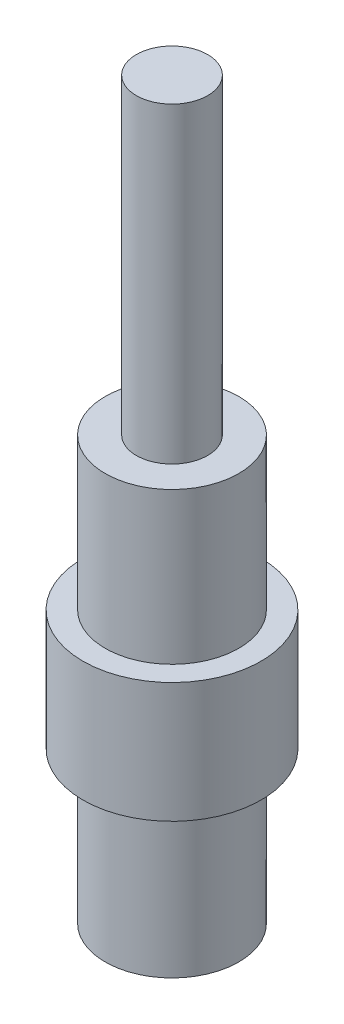
from build123d import *


with BuildPart() as part:
    # Szkic1 → Obrót1 (revolve)
    with BuildSketch(Plane.XY, mode=Mode.PRIVATE) as obr_t1_sk:
        Polygon((4, 47.5), (7.5, 47.5), (7.5, 30.5), (10, 30.5), (10, 17), (7.5, 17), (7.5, 0), (0, 0), (0, 47.5), (0, 82.5), (4, 82.5), align=None)
    revolve(obr_t1_sk.sketch.rotate(Axis((0, 0, 0), (0, 1, 0)), 90), axis=Axis((0, 0, 0), (0, 1, 0)))


solid = part.part
